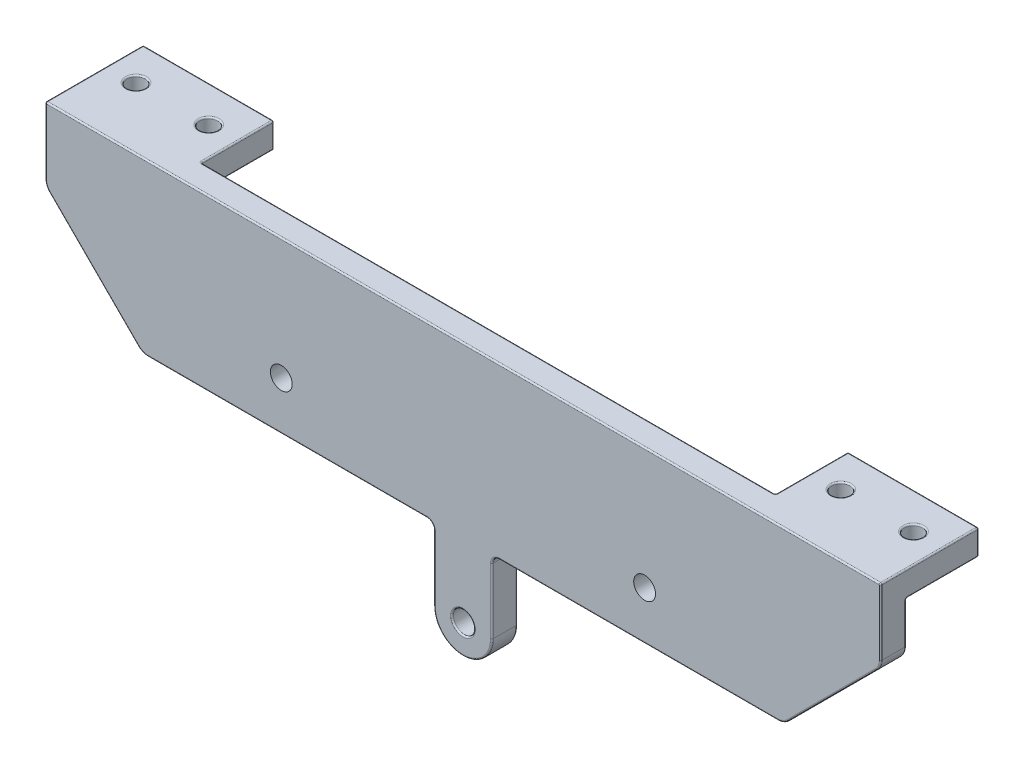
from build123d import *

# Parameters (mm, degrees)
SKETCH5_R           = 4.5
BOSS_EXTRUDE2_DEPTH = 10.5
SKETCH8_W           = 54
SKETCH8_H           = 30
SKETCH8_R           = 3.75
BOSS_EXTRUDE3_DEPTH = 10.5
FILLET1_R           = 6
FILLET3_R           = 3
FILLET5_R           = 0.6
SKETCH11_R          = 4.5
CUT_EXTRUDE3_DEPTH  = 332.417738902
SCALE1_SCALE        = 0.5


with BuildPart() as part:
    # Sketch5 → Boss-Extrude2 (new body)
    with BuildSketch(Plane.XY):
        with BuildLine():
            Line((172.5, 280.073593129), (-172.5, 280.073593129))
            Line((-172.5, 280.073593129), (-172.5, 250.073593129))
            Line((-172.5, 250.073593129), (-132.426406871, 210))
            Line((-132.426406871, 210), (-12, 210))
            Line((-12, 210), (-12, 180))
            ThreePointArc((-12, 180), (0, 168), (12, 180))
            Line((12, 180), (12, 210))
            Line((12, 210), (132.426406871, 210))
            Line((132.426406871, 210), (172.5, 250.073593129))
            Line((172.5, 250.073593129), (172.5, 280.073593129))
        make_face()
        with Locations(Location((0, 180, 0), (0, 0, 180))):
            Circle(SKETCH5_R, mode=Mode.SUBTRACT)
    extrude(amount=BOSS_EXTRUDE2_DEPTH)

    # Sketch8 → Boss-Extrude3 (add)
    # profile 1 of 2: a face of its own
    with BuildSketch(Plane(origin=(0, 280.073593129, 0), x_dir=(1, 0, 0), z_dir=(0, 1, 0))):
        with Locations((-145.5, 15)):
            Rectangle(SKETCH8_W, SKETCH8_H)
        with Locations(Location((-130.5, 15, 0), (0, 0, 270))):
            Circle(SKETCH8_R, mode=Mode.SUBTRACT)
        with Locations(Location((-160.5, 15, 0), (0, 0, 270))):
            Circle(SKETCH8_R, mode=Mode.SUBTRACT)
    # profile 2 of 2: a face of its own
    with BuildSketch(Plane(origin=(0, 280.073593129, 0), x_dir=(1, 0, 0), z_dir=(0, 1, 0))):
        with Locations((145.5, 15)):
            Rectangle(SKETCH8_W, SKETCH8_H)
        with Locations(Location((160.5, 15, 0), (0, 0, 270))):
            Circle(SKETCH8_R, mode=Mode.SUBTRACT)
        with Locations(Location((130.5, 15, 0), (0, 0, 270))):
            Circle(SKETCH8_R, mode=Mode.SUBTRACT)
    extrude(amount=-BOSS_EXTRUDE3_DEPTH)

    # Fillet1
    fillet1_edges = [part.edges().sort_by_distance(p)[0] for p in [
        (172.5, 250.073593129, 5.25),
        (132.426406871, 210, 5.25),
        (-132.426406871, 210, 5.25),
        (-172.5, 250.073593129, 5.25),
    ]]
    fillet(fillet1_edges, radius=FILLET1_R)

    # Fillet3
    fillet3_edges = [part.edges().sort_by_distance(p)[0] for p in [
        (12, 210, 5.25),
        (-12, 210, 5.25),
    ]]
    fillet(fillet3_edges, radius=FILLET3_R)

    # Fillet5
    fillet5_edges = [part.edges().sort_by_distance(p)[0] for p in [
        (12.878679656, 209.121320344, 10.5),
        (-12.878679656, 209.121320344, 0),
        (-12.878679656, 209.121320344, 10.5),
        (12, 193.5, 0),
        (0, 168, 0),
        (-172.5, 280.073593129, -9.75),
        (172.5, 280.073593129, -9.75),
        (0, 168, 10.5),
        (12, 193.5, 10.5),
        (4.5, 180, 0),
        (4.5, 180, 10.5),
        (-172.5, 261.066233816, 0),
        (-172.5, 269.573593129, -15),
        (-145.5, 269.573593129, -30),
        (-172.5, 274.823593129, -30),
        (-118.5, 269.573593129, -15),
        (-118.5, 274.823593129, -30),
        (-145.5, 269.573593129, 0),
        (-118.5, 274.823593129, 0),
        (-160.5, 269.573593129, -18.75),
        (-130.5, 269.573593129, -18.75),
        (-118.5, 280.073593129, -15),
        (-145.5, 280.073593129, -30),
        (-130.5, 280.073593129, -18.75),
        (-160.5, 280.073593129, -18.75),
        (0, 280.073593129, 10.5),
        (0, 280.073593129, 0),
        (-172.5, 266.316233816, 10.5),
        (145.5, 269.573593129, -30),
        (118.5, 274.823593129, -30),
        (172.5, 269.573593129, -15),
        (172.5, 274.823593129, -30),
        (145.5, 269.573593129, 0),
        (118.5, 269.573593129, -15),
        (118.5, 274.823593129, 0),
        (130.5, 269.573593129, -18.75),
        (160.5, 269.573593129, -18.75),
        (145.5, 280.073593129, -30),
        (118.5, 280.073593129, -15),
        (160.5, 280.073593129, -18.75),
        (130.5, 280.073593129, -18.75),
        (172.5, 261.066233816, 0),
        (172.5, 266.316233816, 10.5),
        (152.463203436, 230.036796564, 0),
        (-72.470562748, 210, 0),
        (-152.463203436, 230.036796564, 0),
        (-132.237226091, 210.456722805, 0),
        (-172.043277195, 250.262773909, 0),
        (132.237226091, 210.456722805, 0),
        (172.043277195, 250.262773909, 0),
        (152.463203436, 230.036796564, 10.5),
        (-152.463203436, 230.036796564, 10.5),
        (-72.470562748, 210, 10.5),
        (-132.237226091, 210.456722805, 10.5),
        (-172.043277195, 250.262773909, 10.5),
        (132.237226091, 210.456722805, 10.5),
        (172.043277195, 250.262773909, 10.5),
        (72.470562748, 210, 0),
        (72.470562748, 210, 10.5),
        (-12, 193.5, 0),
        (-12, 193.5, 10.5),
        (12.878679656, 209.121320344, 0),
    ]]
    fillet(fillet5_edges, radius=FILLET5_R)

    # Sketch11 → Cut-Extrude3 (cut, through all)
    with BuildSketch(Plane.XY.offset(10.5)):
        with Locations((75, 230)):
            Circle(SKETCH11_R)
        with Locations((-75, 230)):
            Circle(SKETCH11_R)
    extrude(amount=-CUT_EXTRUDE3_DEPTH, mode=Mode.SUBTRACT)


with BuildPart() as part_1:
    # Scale1: scaled about (0, 248.073762377, 2.902451878)
    add(part.part.scale(SCALE1_SCALE).moved(Location((0, 124.036881189, 1.451225939))))


solid = part_1.part
